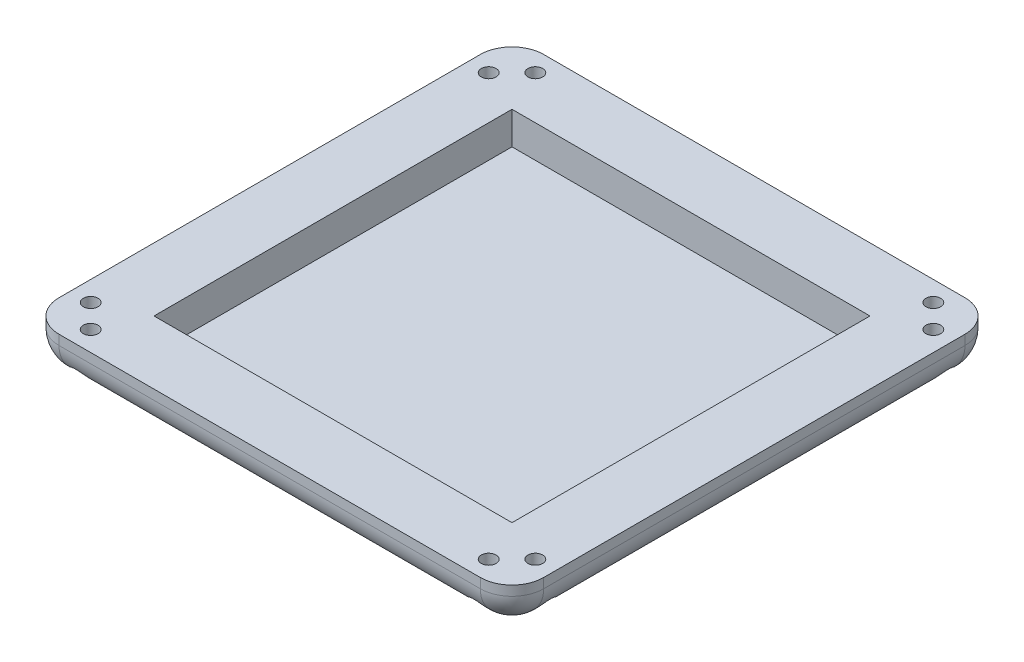
from build123d import *

# Parameters (mm, degrees)
EXTRUDE_1_DEPTH               = 7
SKETCH_2_W                    = 60.5
SKETCH_2_H                    = 60.5
CUT_EXTRUDE_1_DEPTH           = 5.5
FILLET_2_R                    = 5.35
HOLE_WIZARD_M2_51_D           = 2.5
HOLE_WIZARD_M2_51_CBORE_D     = 5
HOLE_WIZARD_M2_51_CBORE_DEPTH = 4


with BuildPart() as part:
    # Эскиз1 → Бобышка-Вытянуть1 (new body)
    with BuildSketch(Plane(origin=(0, 0, 0), x_dir=(1, 0, 0), z_dir=(0, 1, 0))):
        with BuildLine():
            Line((-35.6, 40.95), (35.6, 40.95))
            ThreePointArc((35.6, 40.95), (39.383021279, 39.383021279), (40.95, 35.6))
            Line((40.95, 35.6), (40.95, -35.6))
            ThreePointArc((40.95, -35.6), (39.383021279, -39.383021279), (35.6, -40.95))
            Line((35.6, -40.95), (-35.6, -40.95))
            ThreePointArc((-35.6, -40.95), (-39.383021279, -39.383021279), (-40.95, -35.6))
            Line((-40.95, -35.6), (-40.95, 35.6))
            ThreePointArc((-40.95, 35.6), (-39.383021279, 39.383021279), (-35.6, 40.95))
        make_face()
    extrude(amount=-EXTRUDE_1_DEPTH)

    # Эскиз2 → Вырез-Вытянуть1 (cut)
    with BuildSketch(Plane(origin=(0, 0, 0), x_dir=(-1, 0, 0), z_dir=(0, 1, 0))):
        Rectangle(SKETCH_2_W, SKETCH_2_H)
    extrude(amount=-CUT_EXTRUDE_1_DEPTH, mode=Mode.SUBTRACT)

    # Скругление2
    fillet_2_edges = [part.edges().sort_by_distance(p)[0] for p in [
        (39.383021279, -7, 39.383021279),
        (40.95, -7, 0),
        (39.383021279, -7, -39.383021279),
        (0, -7, -40.95),
        (-39.383021279, -7, -39.383021279),
        (-40.95, -7, 0),
        (-39.383021279, -7, 39.383021279),
        (0, -7, 40.95),
    ]]
    fillet(fillet_2_edges, radius=FILLET_2_R)

    # Цековка для  винта с заклепочной головкой M2.51 (through all)
    with Locations(Plane(origin=(0, -7, 0), x_dir=(-1, 0, 0), z_dir=(0, -1, 0))):
        with Locations((37.57, 33.63), (33.63, 37.57), (37.57, -33.63), (33.63, -37.57), (-33.63, -37.57), (-37.57, -33.63), (-37.57, 33.63), (-33.63, 37.57)):
            CounterBoreHole(HOLE_WIZARD_M2_51_D / 2, HOLE_WIZARD_M2_51_CBORE_D / 2, HOLE_WIZARD_M2_51_CBORE_DEPTH)


solid = part.part
